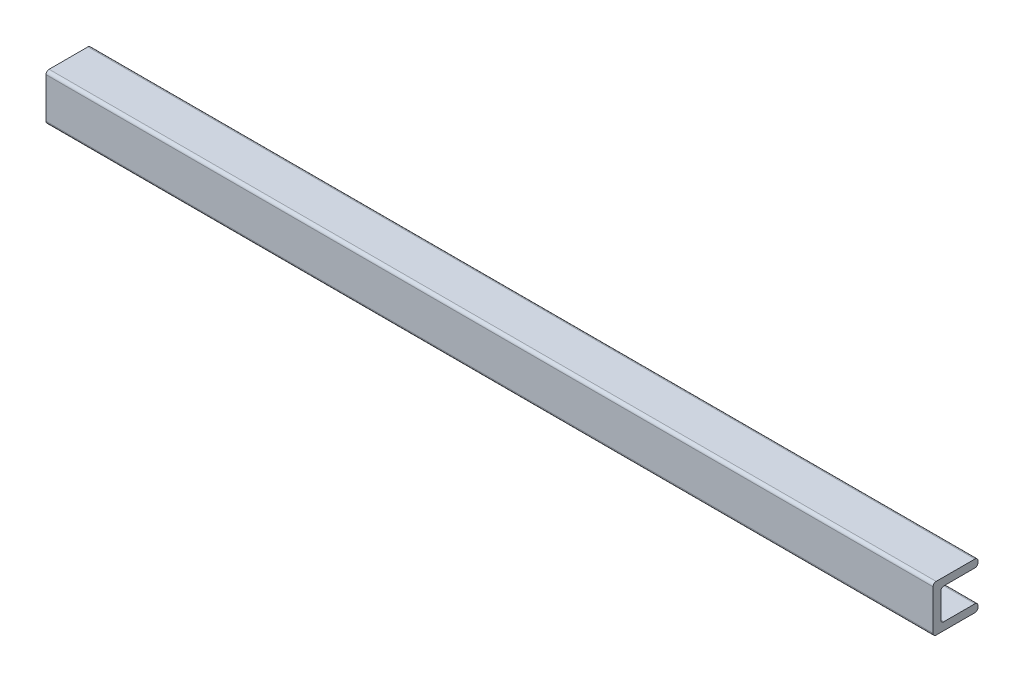
from build123d import *

# Parameters (mm, degrees)
BOSS_EXTRUDE1_START = 30
BOSS_EXTRUDE1_DEPTH = 572
CUT_EXTRUDE1_DEPTH  = 4.5


with BuildPart() as part:
    # Sketch1 → Boss-Extrude1 (new body)
    with BuildSketch(Plane(origin=(0, 0, 0), x_dir=(0, 0, -1), z_dir=(1, 0, 0)).offset(BOSS_EXTRUDE1_START)):
        with BuildLine():
            Line((-168, 10), (-188, 10))
            ThreePointArc((-188, 10), (-189.414213562, 9.414213562), (-190, 8))
            Line((-190, 8), (-190, -8))
            ThreePointArc((-190, -8), (-189.414213562, -9.414213562), (-188, -10))
            Line((-188, -10), (-168, -10))
            ThreePointArc((-168, -10), (-166.585786438, -10.585786438), (-166, -12))
            Line((-166, -12), (-166, -13))
            ThreePointArc((-166, -13), (-166.585786438, -14.414213562), (-168, -15))
            Line((-168, -15), (-193, -15))
            ThreePointArc((-193, -15), (-194.414213562, -14.414213562), (-195, -13))
            Line((-195, -13), (-195, 13))
            ThreePointArc((-195, 13), (-194.414213562, 14.414213562), (-193, 15))
            Line((-193, 15), (-168, 15))
            ThreePointArc((-168, 15), (-166.585786438, 14.414213562), (-166, 13))
            Line((-166, 13), (-166, 12))
            ThreePointArc((-166, 12), (-166.585786438, 10.585786438), (-168, 10))
        make_face()
    extrude(amount=BOSS_EXTRUDE1_DEPTH)

    # Sketch2 → Cut-Extrude1 (cut)
    with BuildSketch(Plane(origin=(0, 0, 190), x_dir=(-1, 0, 0), z_dir=(0, 0, -1))):
        with BuildLine():
            ThreePointArc((-67.75, 0), (-68.409009742, 1.590990258), (-70, 2.25))
            Line((-70, 2.25), (-560, 2.25))
            ThreePointArc((-560, 2.25), (-561.590990258, 1.590990258), (-562.25, 0))
            Line((-562.25, 0), (-67.75, 0))
        make_face()
        with BuildLine():
            ThreePointArc((-70, -2.25), (-68.409009742, -1.590990258), (-67.75, 0))
            Line((-67.75, 0), (-562.25, 0))
            ThreePointArc((-562.25, 0), (-561.590990258, -1.590990258), (-560, -2.25))
            Line((-560, -2.25), (-70, -2.25))
        make_face()
    extrude(amount=-CUT_EXTRUDE1_DEPTH, mode=Mode.SUBTRACT)


solid = part.part
